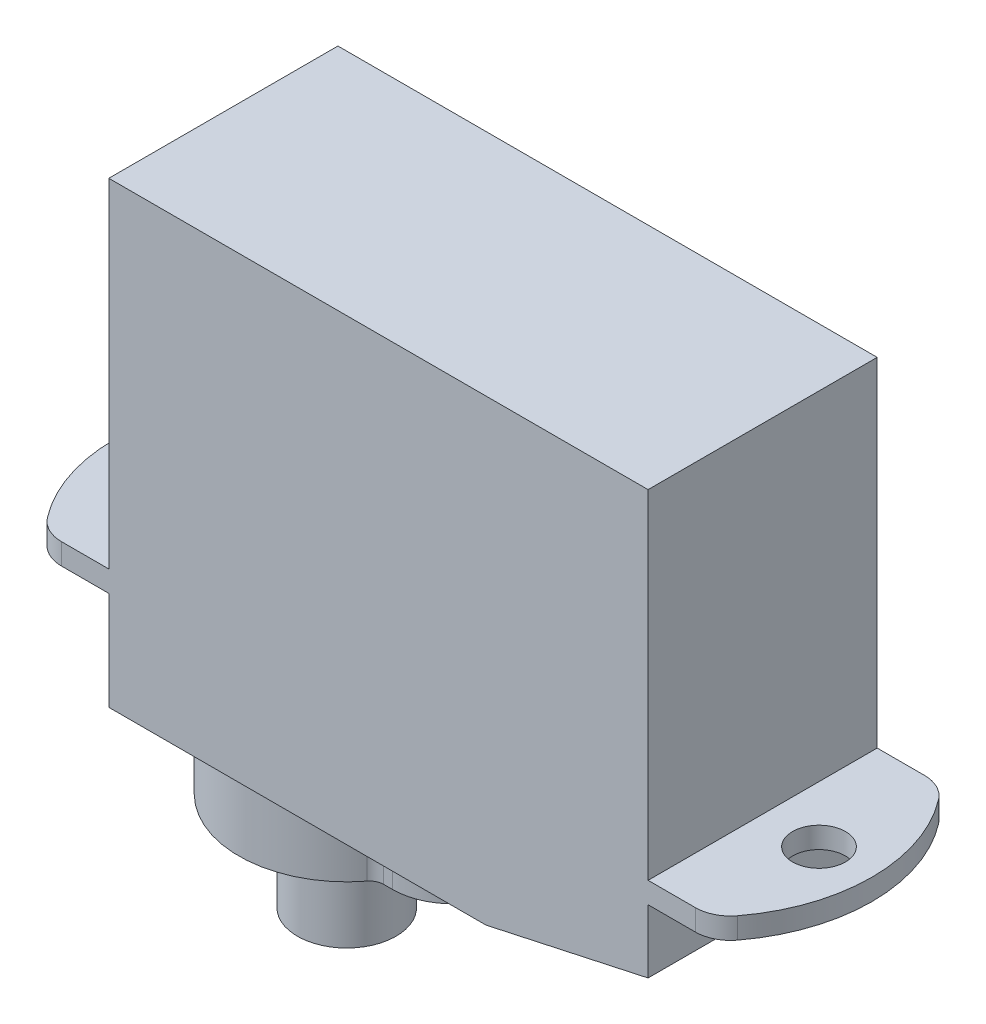
from build123d import *

# Parameters (mm, degrees)
SKETCH1_W           = 19.431
SKETCH1_H           = 8.255
BOSS_EXTRUDE1_DEPTH = 16.51
SKETCH2_R           = 0.9525
BOSS_EXTRUDE2_DEPTH = 0.762
CUT_EXTRUDE1_DEPTH  = 23.959004361
BOSS_EXTRUDE3_DEPTH = 2.54
SKETCH5_R           = 1.778
BOSS_EXTRUDE4_DEPTH = 3.556


with BuildPart() as part:
    # Sketch1 → Boss-Extrude1 (new body)
    with BuildSketch(Plane(origin=(0, 0, 0), x_dir=(1, 0, 0), z_dir=(0, 1, 0))):
        Rectangle(SKETCH1_W, SKETCH1_H)
    extrude(amount=BOSS_EXTRUDE1_DEPTH)

    # Sketch2 → Boss-Extrude2 (add)
    # profile 1 of 2: a face of its own
    with BuildSketch(Plane(origin=(0, 4.318, 0), x_dir=(1, 0, 0), z_dir=(0, 1, 0))):
        with BuildLine():
            Line((9.7155, -4.1275), (9.7155, 4.1275))
            Line((9.7155, 4.1275), (11.417923657, 4.1275))
            ThreePointArc((11.417923657, 4.1275), (11.981565763, 3.995571868), (12.428105113, 3.62719697))
            ThreePointArc((12.428105113, 3.62719697), (13.6525, 0), (12.428105113, -3.62719697))
            ThreePointArc((12.428105113, -3.62719697), (11.981565763, -3.995571868), (11.417923657, -4.1275))
            Line((11.417923657, -4.1275), (9.7155, -4.1275))
        make_face()
        with Locations(Location((11.7475, 0, 0), (0, 0, 270))):
            Circle(SKETCH2_R, mode=Mode.SUBTRACT)
    # profile 2 of 2: a face of its own
    with BuildSketch(Plane(origin=(0, 4.318, 0), x_dir=(1, 0, 0), z_dir=(0, 1, 0))):
        with BuildLine():
            Line((-9.7155, 4.1275), (-9.7155, -4.1275))
            Line((-9.7155, -4.1275), (-11.417923657, -4.1275))
            ThreePointArc((-11.417923657, -4.1275), (-11.981565763, -3.995571868), (-12.428105113, -3.62719697))
            ThreePointArc((-12.428105113, -3.62719697), (-13.6525, 0), (-12.428105113, 3.62719697))
            ThreePointArc((-12.428105113, 3.62719697), (-11.981565763, 3.995571868), (-11.417923657, 4.1275))
            Line((-11.417923657, 4.1275), (-9.7155, 4.1275))
        make_face()
        with Locations(Location((-11.7475, 0, 0), (0, 0, 270))):
            Circle(SKETCH2_R, mode=Mode.SUBTRACT)
    extrude(amount=-BOSS_EXTRUDE2_DEPTH)

    # Sketch3 → Cut-Extrude1 (cut, through all)
    with BuildSketch(Plane.XY.offset(4.1275)):
        Polygon((9.7155, 0), (3.8735, 0), (9.7155, 1.27), align=None)
    extrude(amount=-CUT_EXTRUDE1_DEPTH, mode=Mode.SUBTRACT)

    # Sketch4 → Boss-Extrude3 (add)
    with BuildSketch(Plane.XZ):
        with BuildLine():
            Line((-1.4605, 2.159), (-1.778207824, 2.159))
            ThreePointArc((-1.778207824, 2.159), (-2.003413909, 2.211647148), (-2.181941024, 2.358676301))
            ThreePointArc((-2.181941024, 2.358676301), (-9.1567, 0), (-2.181941024, -2.358676301))
            ThreePointArc((-2.181941024, -2.358676301), (-2.003413909, -2.211647148), (-1.778207824, -2.159))
            Line((-1.778207824, -2.159), (-1.4605, -2.159))
            ThreePointArc((-1.4605, -2.159), (0.6985, 0), (-1.4605, 2.159))
        make_face()
    extrude(amount=BOSS_EXTRUDE3_DEPTH)

    # Sketch5 → Boss-Extrude4 (add)
    with BuildSketch(Plane.XZ.offset(2.54)):
        with Locations(Location((-5.2705, 0, 0), (0, 0, 270))):
            Circle(SKETCH5_R)
    extrude(amount=BOSS_EXTRUDE4_DEPTH)


solid = part.part
